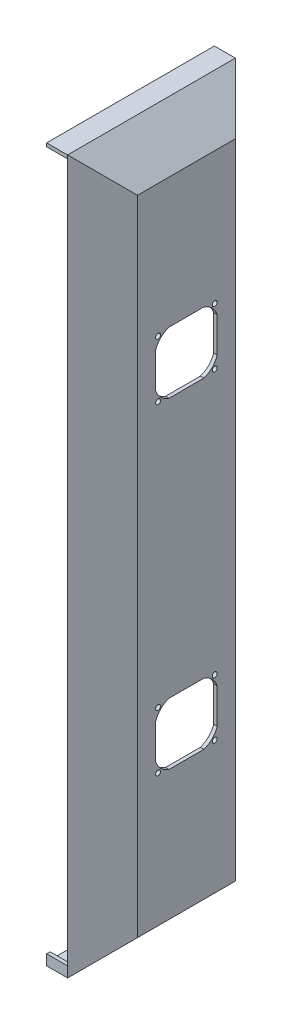
from build123d import *

# Parameters (mm, degrees)
SKETCH2_W               = 152.4
SKETCH2_H               = 647.7
BOSS_EXTRUDE1_DEPTH     = 50.8
CHAMFER1_SIZE           = 31.75
CHAMFER2_SIZE           = 31.75
SHELL1_T                = -3.175
SKETCH3_W               = 3.175
SKETCH3_H               = 635.128365157
SKETCH3_H_2             = 635
CUT_EXTRUDE1_DEPTH      = 19.05
CUT_EXTRUDE2_DEPTH      = 337.55
CUT_EXTRUDE2_DEPTH_BACK = 337.55
SKETCH4_R               = 2.25


with BuildPart() as part:
    # Sketch2 → Boss-Extrude1 (new body)
    with BuildSketch(Plane(origin=(0, 0, 0), x_dir=(0, 0, -1), z_dir=(1, 0, 0))):
        Rectangle(SKETCH2_W, SKETCH2_H)
    extrude(amount=BOSS_EXTRUDE1_DEPTH)

    # Chamfer1
    chamfer1_edges = [part.edges().sort_by_distance(p)[0] for p in [
        (50.8, 0, 76.2),
        (50.8, 0, -76.2),
    ]]
    chamfer(chamfer1_edges, length=CHAMFER1_SIZE)

    # Chamfer2
    chamfer2_edges = [part.edges().sort_by_distance(p)[0] for p in [
        (50.8, -323.85, 0),
        (50.8, 323.85, 0),
    ]]
    chamfer(chamfer2_edges, length=CHAMFER2_SIZE)

    # Shell1
    shell1_openings = [part.faces().sort_by_distance(p)[0] for p in [
        (0, 0, 0),
    ]]
    offset(amount=SHELL1_T, openings=shell1_openings, kind=Kind.INTERSECTION)

    # Sketch3 → Cut-Extrude1 (cut)
    with BuildSketch(Plane.ZY):
        with Locations((-74.6125, 3.110817422)):
            Rectangle(SKETCH3_W, SKETCH3_H)
        with Locations((74.6125, 3.175)):
            Rectangle(SKETCH3_W, SKETCH3_H_2)
    extrude(amount=-CUT_EXTRUDE1_DEPTH, mode=Mode.SUBTRACT)

    # Sketch4 → Cut-Extrude2 (cut, two sides: drawn at the far end of the back side and taken through both)
    with BuildSketch(Plane(origin=(50.8, 0, 0), x_dir=(0, 0, -1), z_dir=(1, 0, 0)).offset(-CUT_EXTRUDE2_DEPTH_BACK)):
        with Locations(Location((-25.75, 171.8, 0), (0, 0, 180))):
            Circle(SKETCH4_R)
        with Locations(Location((25.75, 171.8, 0), (0, 0, 180))):
            Circle(SKETCH4_R)
        with Locations(Location((-25.75, 120.3, 0), (0, 0, 180))):
            Circle(SKETCH4_R)
        with Locations(Location((25.75, 120.3, 0), (0, 0, 180))):
            Circle(SKETCH4_R)
        with Locations(Location((-25.75, -120.3, 0), (0, 0, 180))):
            Circle(SKETCH4_R)
        with Locations(Location((25.75, -120.3, 0), (0, 0, 180))):
            Circle(SKETCH4_R)
        with Locations(Location((25.75, -171.8, 0), (0, 0, 180))):
            Circle(SKETCH4_R)
        with Locations(Location((-25.75, -171.8, 0), (0, 0, 180))):
            Circle(SKETCH4_R)
        with BuildLine():
            Line((-27.98, 161.925), (-27.98, 130.175))
            ThreePointArc((-27.98, 130.175), (-23.3638286, 122.6861714), (-15.875, 118.07))
            Line((-15.875, 118.07), (15.875, 118.07))
            ThreePointArc((15.875, 118.07), (23.3638286, 122.6861714), (27.98, 130.175))
            Line((27.98, 130.175), (27.98, 161.925))
            ThreePointArc((27.98, 161.925), (23.3638286, 169.4138286), (15.875, 174.03))
            Line((15.875, 174.03), (-15.875, 174.03))
            ThreePointArc((-15.875, 174.03), (-23.3638286, 169.4138286), (-27.98, 161.925))
        make_face()
        with BuildLine():
            Line((-27.98, -161.925), (-27.98, -130.175))
            ThreePointArc((-27.98, -130.175), (-23.3638286, -122.6861714), (-15.875, -118.07))
            Line((-15.875, -118.07), (15.875, -118.07))
            ThreePointArc((15.875, -118.07), (23.3638286, -122.6861714), (27.98, -130.175))
            Line((27.98, -130.175), (27.98, -161.925))
            ThreePointArc((27.98, -161.925), (23.3638286, -169.4138286), (15.875, -174.03))
            Line((15.875, -174.03), (-15.875, -174.03))
            ThreePointArc((-15.875, -174.03), (-23.3638286, -169.4138286), (-27.98, -161.925))
        make_face()
    extrude(amount=CUT_EXTRUDE2_DEPTH + CUT_EXTRUDE2_DEPTH_BACK, mode=Mode.SUBTRACT)


solid = part.part
